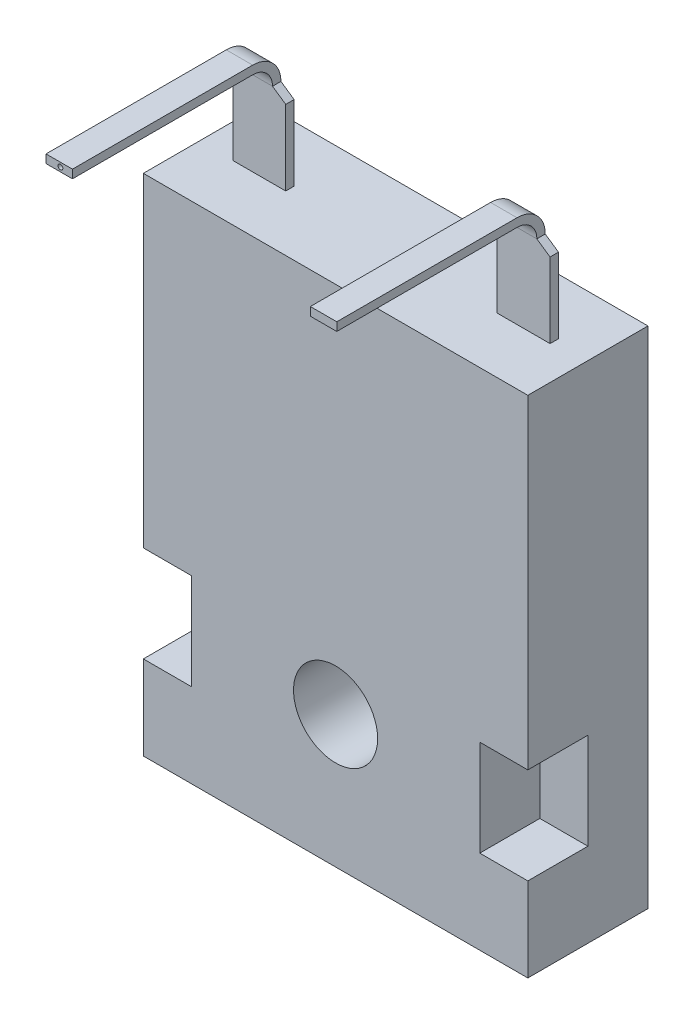
from build123d import *

# Parameters (mm, degrees)
SKETCH_1_W          = 16
SKETCH_1_H          = 21
SKETCH_1_R          = 1.75
EXTRUDE_1_DEPTH     = 5
EXTRUDE_1_2_DEPTH   = 16
CUT_EXTRUDE_1_DEPTH = 16
SKETCH_4_W          = 3.81913455
SKETCH_4_H          = 4
CUT_EXTRUDE_2_DEPTH = 2.5
SKETCH_5_R          = 0.1
CUT_EXTRUDE_3_DEPTH = 2
SKETCH_6_W          = 6.153050109
SKETCH_6_H          = 6.032352941
CUT_EXTRUDE_4_DEPTH = 10


with BuildPart() as part:
    # Эскиз1 → Extrude 1 (new body)
    with BuildSketch(Plane.XY):
        with Locations((0, 5)):
            Rectangle(SKETCH_1_W, SKETCH_1_H)
        Circle(SKETCH_1_R, mode=Mode.SUBTRACT)
    extrude(amount=EXTRUDE_1_DEPTH)

    # Эскиз2 → Extrude 1 2 (add)
    with BuildSketch(Plane.ZY.offset(8)):
        with BuildLine():
            Line((2.675, 15.5), (2.675, 19))
            ThreePointArc((2.675, 19), (2.916636906, 19.583363094), (3.5, 19.825))
            Line((3.5, 19.825), (11, 19.825))
            Line((11, 19.825), (11, 20.175))
            Line((11, 20.175), (3.5, 20.175))
            ThreePointArc((3.5, 20.175), (2.669149532, 19.830850468), (2.325, 19))
            Line((2.325, 19), (2.325, 15.5))
            Line((2.325, 15.5), (2.675, 15.5))
        make_face()
    extrude(amount=-EXTRUDE_1_2_DEPTH)

    # Эскиз3 → Вырез-Вытянуть1 (cut)
    with BuildSketch(Plane(origin=(0, 0, 2.325), x_dir=(-1, 0, 0), z_dir=(0, 0, -1))):
        Polygon((-1.75, 15.5), (-1.75, 18.5), (-0.55, 19), (-0.55, 20.937907948), (-4.95, 20.937907948), (-4.95, 19), (-4.4, 18.622085888), (-4.4, 15.5), align=None)
        Polygon((0.55, 19), (0.55, 20.937907948), (4.95, 20.937907948), (4.95, 19), (4.4, 18.622085888), (4.4, 15.5), (1.75, 15.5), (1.75, 18.5), align=None)
        Polygon((-6.05, 19), (-6.05, 20.937907948), (-9.320905805, 20.937907948), (-9.320905805, 15.5), (-6.6, 15.5), (-6.6, 18.622085888), align=None)
        Polygon((6.05, 19), (6.05, 20.937907948), (9.499807758, 20.937907948), (9.499807758, 15.5), (6.6, 15.5), (6.6, 18.622085888), align=None)
    extrude(amount=-CUT_EXTRUDE_1_DEPTH, mode=Mode.SUBTRACT)

    # Эскиз4 → Вырез-Вытянуть2 (cut)
    with BuildSketch(Plane(origin=(0, 0, 5), x_dir=(-1, 0, 0), z_dir=(0, 0, -1))):
        with Locations((7.909567275, 0)):
            Rectangle(SKETCH_4_W, SKETCH_4_H)
        with Locations((-7.909567275, 0)):
            Rectangle(SKETCH_4_W, SKETCH_4_H)
    extrude(amount=CUT_EXTRUDE_2_DEPTH, mode=Mode.SUBTRACT)

    # Эскиз5 → Вырез-Вытянуть3 (cut)
    with BuildSketch(Plane.XY.offset(11)):
        with Locations((-5.45, 20)):
            Circle(SKETCH_5_R)
    extrude(amount=-CUT_EXTRUDE_3_DEPTH, mode=Mode.SUBTRACT)

    # Эскиз6 → Вырез-Вытянуть4 (cut)
    with BuildSketch(Plane(origin=(0, 0, 2.325), x_dir=(-1, 0, 0), z_dir=(0, 0, -1))):
        with Locations((0.350490197, 18.516176471)):
            Rectangle(SKETCH_6_W, SKETCH_6_H)
    extrude(amount=-CUT_EXTRUDE_4_DEPTH, mode=Mode.SUBTRACT)


solid = part.part
